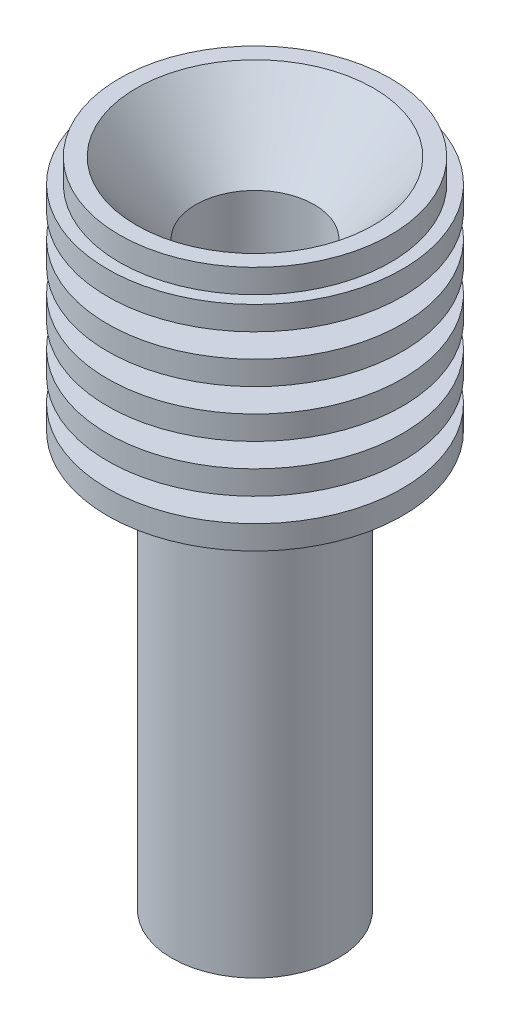
from build123d import *

# Parameters (mm, degrees)
CROQUIS2_R              = 7
SALIENTE_EXTRUIR1_DEPTH = 55
CROQUIS3_R              = 12.425
SALIENTE_EXTRUIR2_DEPTH = 20
CROQUIS4_R              = 5
CORTAR_EXTRUIR1_DEPTH   = 47
CROQUIS7_R              = 3
CORTAR_EXTRUIR2_DEPTH   = 8


with BuildPart() as part:
    # Croquis2 → Saliente-Extruir1 (new body)
    with BuildSketch(Plane(origin=(0, 0, 0), x_dir=(1, 0, 0), z_dir=(0, 1, 0))):
        with Locations(Location((0, 0, 0), (0, 0, 270))):
            Circle(CROQUIS2_R)
    extrude(amount=SALIENTE_EXTRUIR1_DEPTH)

    # Croquis3 → Saliente-Extruir2 (add)
    with BuildSketch(Plane(origin=(0, 55, 0), x_dir=(1, 0, 0), z_dir=(0, 1, 0))):
        with Locations(Location((0, 0, 0), (0, 0, 270))):
            Circle(CROQUIS3_R)
    extrude(amount=-SALIENTE_EXTRUIR2_DEPTH)

    # Croquis4 → Cortar-Extruir1 (cut)
    with BuildSketch(Plane(origin=(0, 55, 0), x_dir=(1, 0, 0), z_dir=(0, 1, 0))):
        with Locations(Location((0, 0, 0), (0, 0, 270))):
            Circle(CROQUIS4_R)
    extrude(amount=-CORTAR_EXTRUIR1_DEPTH, mode=Mode.SUBTRACT)

    # Croquis7 → Cortar-Extruir2 (cut)
    with BuildSketch(Plane.XZ):
        with Locations(Location((0, 0, 0), (0, 0, 270))):
            Circle(CROQUIS7_R)
    extrude(amount=-CORTAR_EXTRUIR2_DEPTH, mode=Mode.SUBTRACT)

    # Croquis5 → Cortar-Revolución1 (revolve, cut)
    with BuildSketch(Plane.XY, mode=Mode.PRIVATE) as cortar_revoluci_n1_sk:
        Polygon((-5, 49), (0, 49), (0, 63.271347918), (-20.39383665, 63.271347918), (-20.39383665, 37), (-12.425, 37), (-7, 37), (-7, 39), (-12.425, 39), (-12.425, 41), (-7, 41), (-7, 43), (-12.425, 43), (-12.425, 45), (-7, 45), (-7, 47), (-12.425, 47), (-12.425, 49), (-8.025, 49), (-8.025, 51), (-12.425, 51), (-12.425, 53), (-11.425, 53), (-11.425, 55), (-10, 55), align=None)
    revolve(cortar_revoluci_n1_sk.sketch.rotate(Axis((0, 0, 0), (0, 1, 0)), 270), axis=Axis((0, 0, 0), (0, 1, 0)), mode=Mode.SUBTRACT)


solid = part.part
